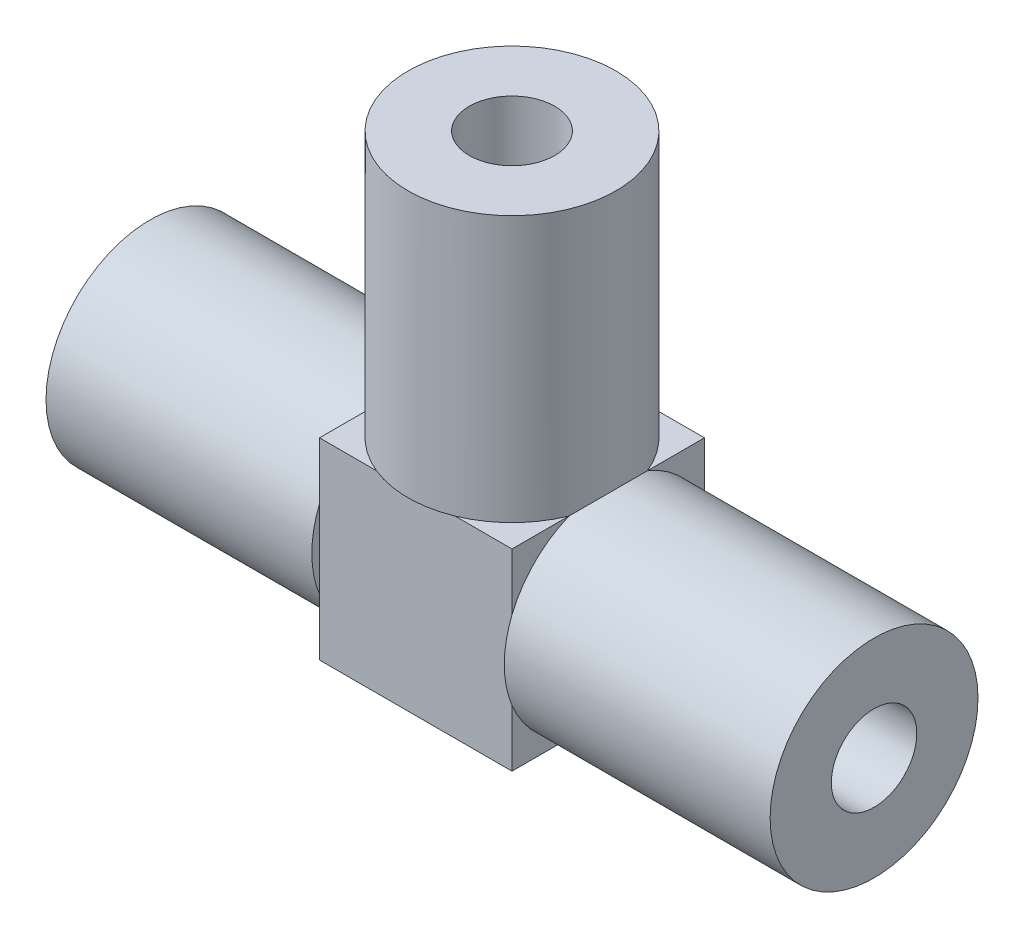
from build123d import *

# Parameters (mm, degrees)
BLOCK_SKETCH_W      = 14.3
BLOCK_SKETCH_H      = 14.3
BLOCK_DEPTH         = 7.15
ARM_X_SKETCH_W      = 19.75
ARM_X_SKETCH_H      = 7.722
ARM_Y_SKETCH_W      = 7.722
ARM_Y_SKETCH_H      = 19.75
SOCKET_X_SKETCH_W   = 16.2
SOCKET_X_SKETCH_H   = 3.175
SOCKET_Y_SKETCH_W   = 3.175
SOCKET_Y_SKETCH_H   = 16.2
ARM_X_SKETCH_2_W    = 19.75
ARM_X_SKETCH_2_H    = 7.722
SOCKET_X_SKETCH_2_W = 16.2
SOCKET_X_SKETCH_2_H = 3.175


with BuildPart() as part:
    # Block Sketch → Block (new, symmetric)
    with BuildSketch(Plane.XY):
        Rectangle(BLOCK_SKETCH_W, BLOCK_SKETCH_H)
    extrude(amount=BLOCK_DEPTH, both=True)

    # Arm X Sketch → Arm X (revolve)
    with BuildSketch(Plane.XY):
        with Locations((17.025, 3.861)):
            Rectangle(ARM_X_SKETCH_W, ARM_X_SKETCH_H)
    revolve(axis=Axis((-1000, 0, 0), (1, 0, 0)))

    # Arm Y Sketch → Arm Y (revolve)
    with BuildSketch(Plane.XY):
        with Locations((3.861, 17.025)):
            Rectangle(ARM_Y_SKETCH_W, ARM_Y_SKETCH_H)
    revolve(axis=Axis((0, -500, 0), (0, 1, 0)))

    # Socket X Sketch → Socket X (revolve, cut)
    with BuildSketch(Plane.XY):
        with Locations((19.8, 1.5875)):
            Rectangle(SOCKET_X_SKETCH_W, SOCKET_X_SKETCH_H)
    revolve(axis=Axis((-1000, 0, 0), (1, 0, 0)), mode=Mode.SUBTRACT)

    # Socket Y Sketch → Socket Y (revolve, cut)
    with BuildSketch(Plane.XY):
        with Locations((1.5875, 19.8)):
            Rectangle(SOCKET_Y_SKETCH_W, SOCKET_Y_SKETCH_H)
    revolve(axis=Axis((0, -500, 0), (0, 1, 0)), mode=Mode.SUBTRACT)

    # Arm -X Sketch 2 → Arm -X 2 (revolve)
    with BuildSketch(Plane.XY):
        with Locations((-17.025, 3.861)):
            Rectangle(ARM_X_SKETCH_2_W, ARM_X_SKETCH_2_H)
    revolve(axis=Axis((-1000, 0, 0), (1, 0, 0)))

    # Socket -X Sketch 2 → Socket -X 2 (revolve, cut)
    with BuildSketch(Plane.XY):
        with Locations((-19.8, 1.5875)):
            Rectangle(SOCKET_X_SKETCH_2_W, SOCKET_X_SKETCH_2_H)
    revolve(axis=Axis((-1000, 0, 0), (1, 0, 0)), mode=Mode.SUBTRACT)


solid = part.part
